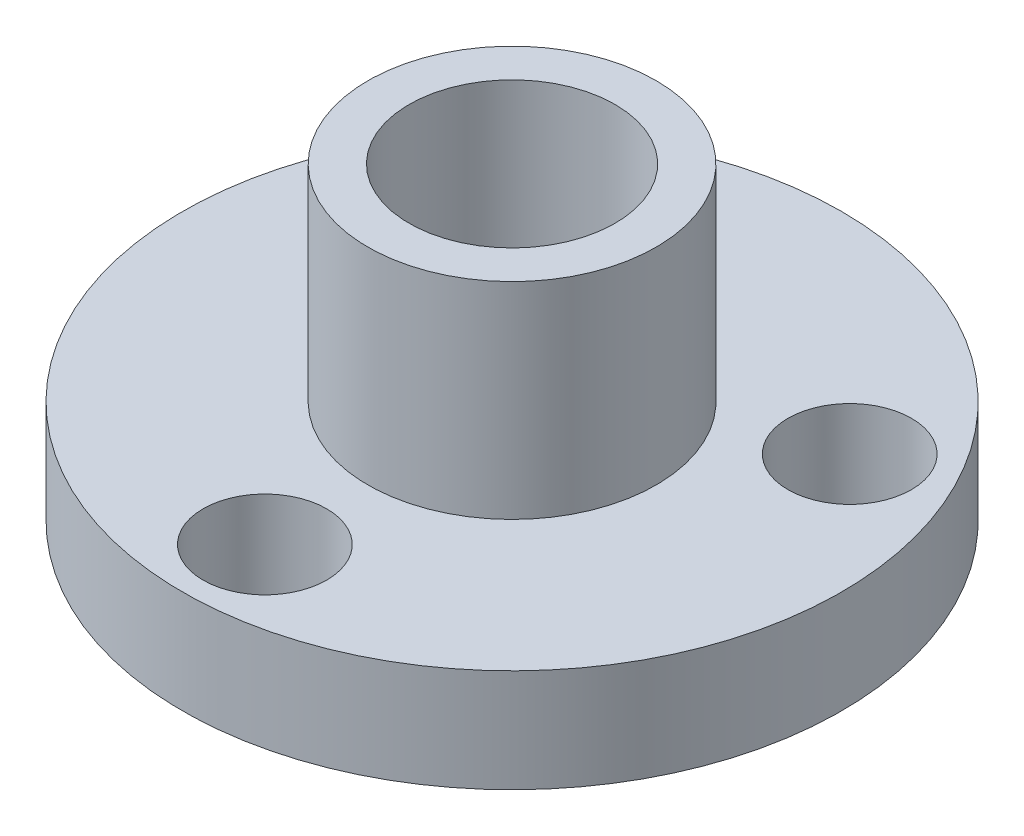
from build123d import *

# Parameters (mm, degrees)
ESQUISSE2_R             = 1.5
ENL_V_MAT_EXTRU_1_DEPTH = 14.57387196


with BuildPart() as part:
    # Esquisse1 → Révolution1 (revolve)
    with BuildSketch(Plane.XY, mode=Mode.PRIVATE) as r_volution1_sk:
        Polygon((2.5, 0), (8, 0), (8, 2.5), (3.5, 2.5), (3.5, 7.5), (2.5, 7.5), align=None)
    revolve(r_volution1_sk.sketch.rotate(Axis((0, 0, 0), (0, 1, 0)), 90), axis=Axis((0, 0, 0), (0, 1, 0)))

    # Esquisse2 → Enlèv. mat.-Extru.1 (cut, through all)
    with BuildSketch(Plane.XZ):
        with Locations(Location((0, 6, 0), (0, 0, 270))):
            Circle(ESQUISSE2_R)
        with Locations(Location((5.196152423, -3, 0), (0, 0, 270))):
            Circle(ESQUISSE2_R)
        with Locations(Location((-5.196152423, -3, 0), (0, 0, 270))):
            Circle(ESQUISSE2_R)
    extrude(amount=-ENL_V_MAT_EXTRU_1_DEPTH, mode=Mode.SUBTRACT)


solid = part.part
